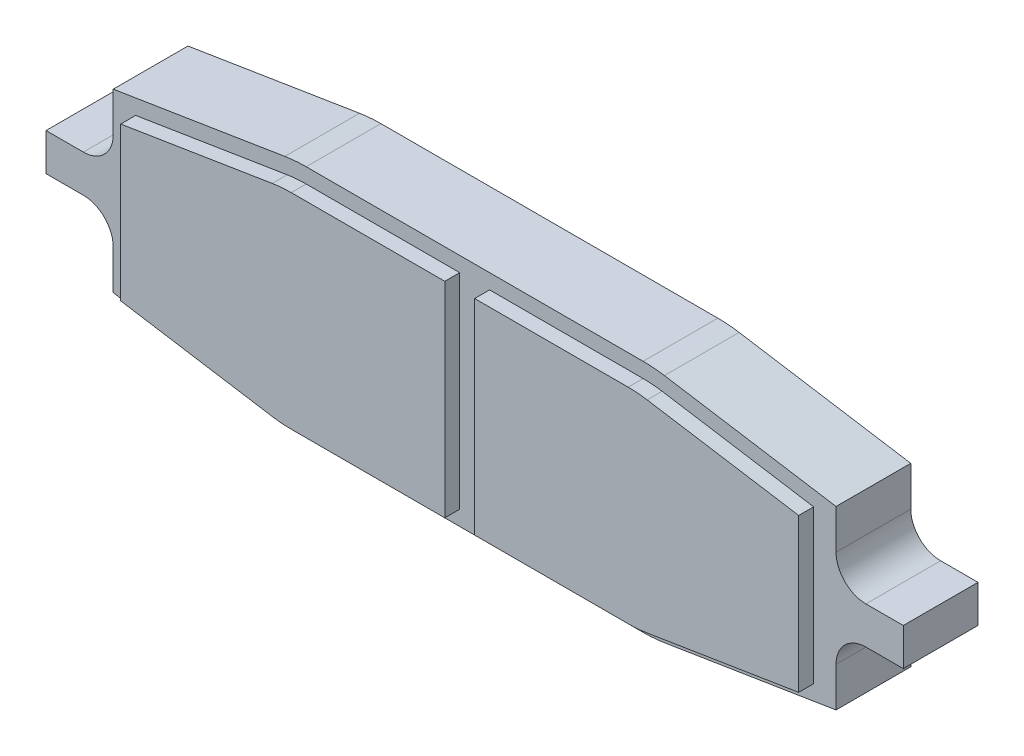
from build123d import *

# Parameters (mm, degrees)
BOSS_EXTRUDE1_DEPTH = 10
BOSS_EXTRUDE2_DEPTH = 2


with BuildPart() as part:
    # Sketch1 → Boss-Extrude1 (new body)
    with BuildSketch(Plane.XY):
        with BuildLine():
            Line((-52.370168415, -5.10038319), (-57.370168415, -5.10038319))
            Line((-57.370168415, -5.10038319), (-57.370168415, -0.10038319))
            Line((-57.370168415, -0.10038319), (-52.370168415, -0.10038319))
            ThreePointArc((-52.370168415, -0.10038319), (-49.54174129, 1.071189685), (-48.370168415, 3.89961681))
            Line((-48.370168415, 3.89961681), (-48.370168415, 9.195191959))
            Line((-48.370168415, 9.195191959), (-25.403732634, 12.883646701))
            ThreePointArc((-25.403732634, 12.883646701), (-23.981138375, 13.054361886), (-22.549472845, 13.111387389))
            Line((-22.549472845, 13.111387389), (22.549472845, 13.111387389))
            ThreePointArc((22.549472845, 13.111387389), (23.981138375, 13.054361886), (25.403732634, 12.883646701))
            Line((25.403732634, 12.883646701), (48.370168415, 9.195191959))
            Line((48.370168415, 9.195191959), (48.370168415, 3.89961681))
            ThreePointArc((48.370168415, 3.89961681), (49.54174129, 1.071189685), (52.370168415, -0.10038319))
            Line((52.370168415, -0.10038319), (57.370168415, -0.10038319))
            Line((57.370168415, -0.10038319), (57.370168415, -5.10038319))
            Line((57.370168415, -5.10038319), (52.370168415, -5.10038319))
            ThreePointArc((52.370168415, -5.10038319), (49.54174129, -6.271956065), (48.370168415, -9.10038319))
            Line((48.370168415, -9.10038319), (48.370168415, -14.395958339))
            Line((48.370168415, -14.395958339), (25.403732634, -18.084413081))
            ThreePointArc((25.403732634, -18.084413081), (23.981138375, -18.255128266), (22.549472845, -18.312153769))
            Line((22.549472845, -18.312153769), (-22.549472845, -18.312153769))
            ThreePointArc((-22.549472845, -18.312153769), (-23.981138375, -18.255128266), (-25.403732634, -18.084413081))
            Line((-25.403732634, -18.084413081), (-48.370168415, -14.395958339))
            Line((-48.370168415, -14.395958339), (-48.370168415, -9.10038319))
            ThreePointArc((-48.370168415, -9.10038319), (-49.54174129, -6.271956065), (-52.370168415, -5.10038319))
        make_face()
    extrude(amount=BOSS_EXTRUDE1_DEPTH)

    # Sketch2 → Boss-Extrude2 (add)
    with BuildSketch(Plane.XY.offset(10)):
        with BuildLine():
            Line((-2, 11.111387389), (-2, -16.312153769))
            Line((-2, -16.312153769), (-22.549472845, -16.312153769))
            ThreePointArc((-22.549472845, -16.312153769), (-23.822064428, -16.261464433), (-25.086592657, -16.109717602))
            Line((-25.086592657, -16.109717602), (-45.370168415, -12.852135455))
            Line((-45.370168415, -12.852135455), (-45.370168415, 7.651369075))
            Line((-45.370168415, 7.651369075), (-25.086592657, 10.908951222))
            ThreePointArc((-25.086592657, 10.908951222), (-23.822064428, 11.060698053), (-22.549472845, 11.111387389))
            Line((-22.549472845, 11.111387389), (-2, 11.111387389))
        make_face()
        with BuildLine():
            Line((2, 11.111387389), (2, -16.312153769))
            Line((2, -16.312153769), (22.549472845, -16.312153769))
            ThreePointArc((22.549472845, -16.312153769), (23.822064428, -16.261464433), (25.086592657, -16.109717602))
            Line((25.086592657, -16.109717602), (45.370168415, -12.852135455))
            Line((45.370168415, -12.852135455), (45.370168415, 7.651369075))
            Line((45.370168415, 7.651369075), (25.086592657, 10.908951222))
            ThreePointArc((25.086592657, 10.908951222), (23.822064428, 11.060698053), (22.549472845, 11.111387389))
            Line((22.549472845, 11.111387389), (2, 11.111387389))
        make_face()
    extrude(amount=BOSS_EXTRUDE2_DEPTH)


solid = part.part
